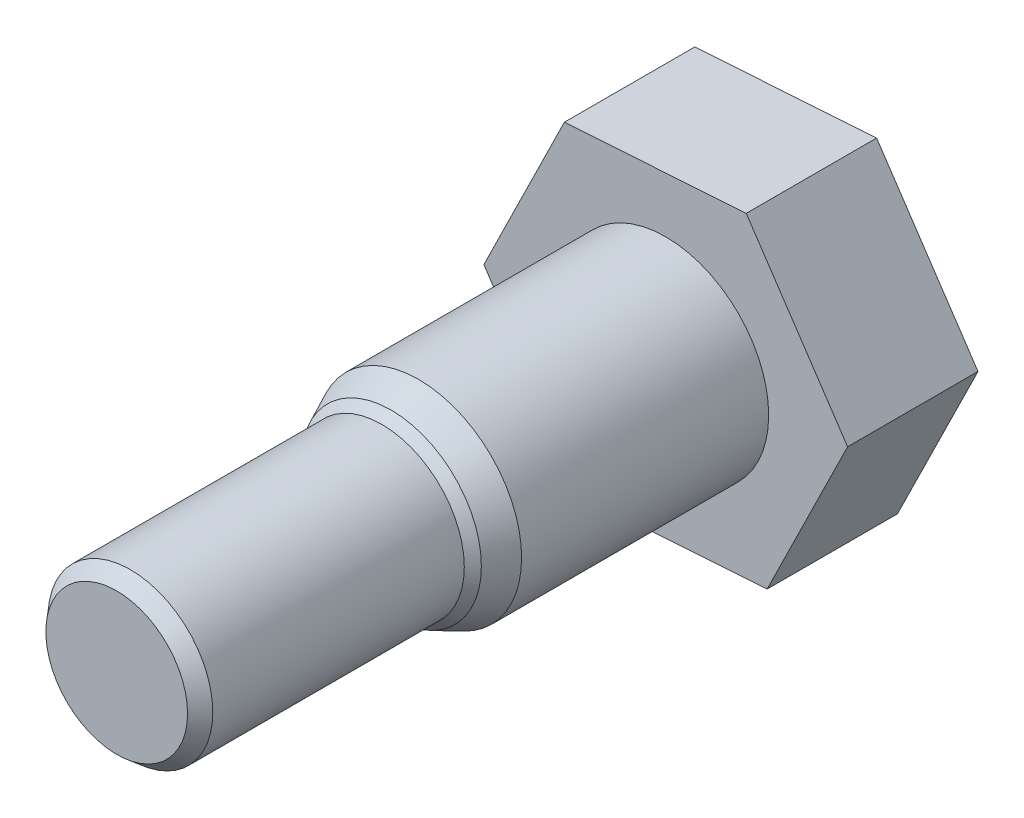
from build123d import *

# Parameters (mm, degrees)
SKETCH_1_R      = 15
EXTRUDE_1_DEPTH = 1
EXTRUDE_2_DEPTH = 19
SKETCH_9_R      = 15
EXTRUDE_3_DEPTH = 36
SKETCH_11_R     = 15
EXTRUDE_6_DEPTH = 4
EXTRUDE_6_TAPER = 25
SKETCH_12_R     = 12
EXTRUDE_7_DEPTH = 38
SKETCH_13_R     = 13.134769367
EXTRUDE_8_DEPTH = 2
EXTRUDE_8_TAPER = 40
SKETCH_15_R     = 12
EXTRUDE_9_DEPTH = 2
EXTRUDE_9_TAPER = 40


with BuildPart() as part:
    # 草图1 → 拉伸1 (new body)
    with BuildSketch(Plane.XY):
        Circle(SKETCH_1_R)
    extrude(amount=EXTRUDE_1_DEPTH)

    # 草图2 → 拉伸2 (add)
    with BuildSketch(Plane.XY):
        Polygon((14.770690633, -22.071702054), (26.5, 1.755942292), (11.729309367, 23.827644346), (-14.770690633, 22.071702054), (-26.5, -1.755942292), (-11.729309367, -23.827644346), align=None)
    extrude(amount=EXTRUDE_2_DEPTH)

    # 草图9 → 拉伸3 (add)
    with BuildSketch(Plane.XY.offset(19)):
        Circle(SKETCH_9_R)
    extrude(amount=EXTRUDE_3_DEPTH)

    # 草图11 → 拉伸6 (add)
    with BuildSketch(Plane.XY.offset(55)):
        Circle(SKETCH_11_R)
    extrude(amount=EXTRUDE_6_DEPTH, taper=EXTRUDE_6_TAPER)

    # 草图12 → 拉伸7 (add)
    with BuildSketch(Plane.XY.offset(59)):
        Circle(SKETCH_12_R)
    extrude(amount=EXTRUDE_7_DEPTH)

    # 草图13 → 拉伸8 (add)
    with BuildSketch(Plane.XY.offset(59)):
        Circle(SKETCH_13_R)
    extrude(amount=EXTRUDE_8_DEPTH, taper=EXTRUDE_8_TAPER)

    # 草图15 → 拉伸9 (add)
    with BuildSketch(Plane.XY.offset(97)):
        Circle(SKETCH_15_R)
    extrude(amount=EXTRUDE_9_DEPTH, taper=EXTRUDE_9_TAPER)


solid = part.part
